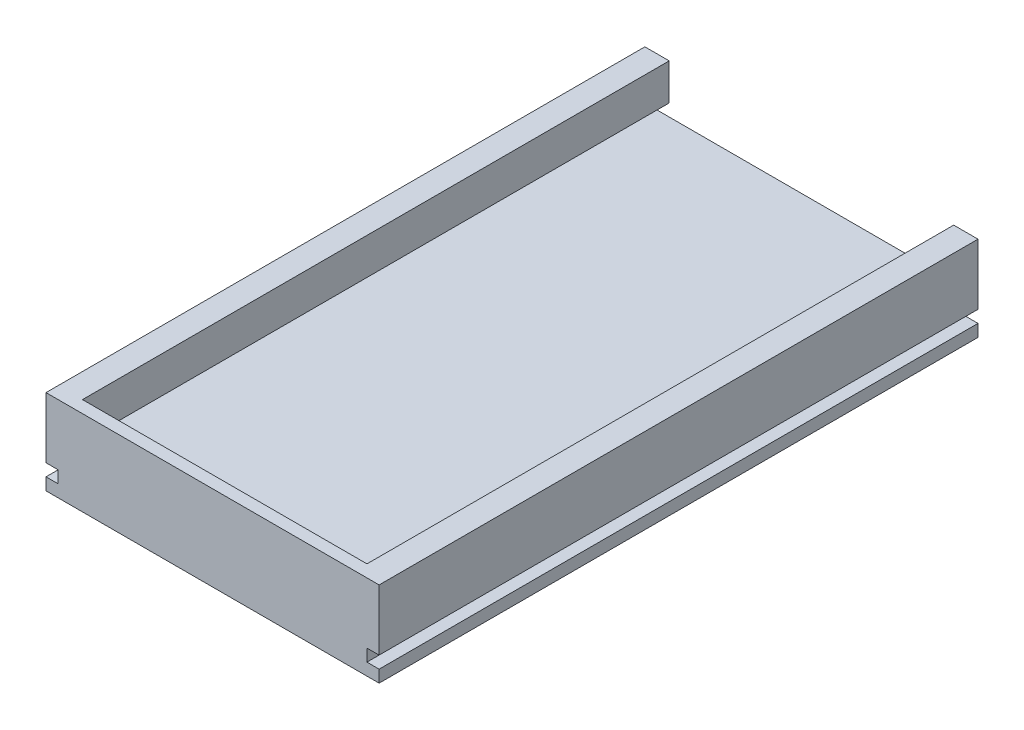
from build123d import *

# Parameters (mm, degrees)
CROQUIS11_W             = 27.4
CROQUIS11_H             = 49.26
SALIENTE_EXTRUIR3_DEPTH = 3
CORTAR_EXTRUIR1_DEPTH   = 56
SALIENTE_EXTRUIR4_DEPTH = 49.26
CROQUIS24_W             = 25.4
CROQUIS24_H             = 1
SALIENTE_EXTRUIR6_DEPTH = 2
SALIENTE_EXTRUIR7_DEPTH = 2


with BuildPart() as part:
    # Croquis11 → Saliente-Extruir3 (new body)
    with BuildSketch(Plane(origin=(0, 0, 0), x_dir=(1, 0, 0), z_dir=(0, 1, 0))):
        Rectangle(CROQUIS11_W, CROQUIS11_H)
    extrude(amount=SALIENTE_EXTRUIR3_DEPTH)

    # Croquis21 → Cortar-Extruir1 (cut)
    with BuildSketch(Plane(origin=(0, 0, -24.63), x_dir=(-1, 0, 0), z_dir=(0, 0, -1))):
        Polygon((-12.7, 2), (-13.7, 2), (-13.7, 1.5), (-13.7, 1), (-12.7, 1), (-12.7, 1.5), align=None)
        Polygon((13.7, 2), (12.7, 2), (12.7, 1.5), (12.7, 1), (13.7, 1), (13.7, 1.5), align=None)
    extrude(amount=-CORTAR_EXTRUIR1_DEPTH, mode=Mode.SUBTRACT)

    # Croquis23 → Saliente-Extruir4 (add)
    with BuildSketch(Plane.XY.offset(24.63)):
        Polygon((-13.7, 5), (-13.7, 3), (-12.7, 3), (-12.7, 4), (-11.7, 4), (-11.7, 5), align=None)
        Polygon((12.7, 4), (12.7, 3), (13.7, 3), (13.7, 5), (11.7, 5), (11.7, 4), align=None)
    extrude(amount=-SALIENTE_EXTRUIR4_DEPTH)

    # Croquis24 → Saliente-Extruir6 (add)
    with BuildSketch(Plane(origin=(0, 3, 0), x_dir=(1, 0, 0), z_dir=(0, 1, 0))):
        with Locations((0, -24.13)):
            Rectangle(CROQUIS24_W, CROQUIS24_H)
    extrude(amount=SALIENTE_EXTRUIR6_DEPTH)

    # Croquis26 → Saliente-Extruir7 (add)
    with BuildSketch(Plane(origin=(0, 5, 0), x_dir=(1, 0, 0), z_dir=(0, 1, 0))):
        Polygon((-13.7, 24.63), (-11.7, 24.63), (-11.7, -23.63), (11.7, -23.63), (11.7, 24.63), (13.7, 24.63), (13.7, -24.63), (-13.7, -24.63), align=None)
    extrude(amount=SALIENTE_EXTRUIR7_DEPTH)


solid = part.part
